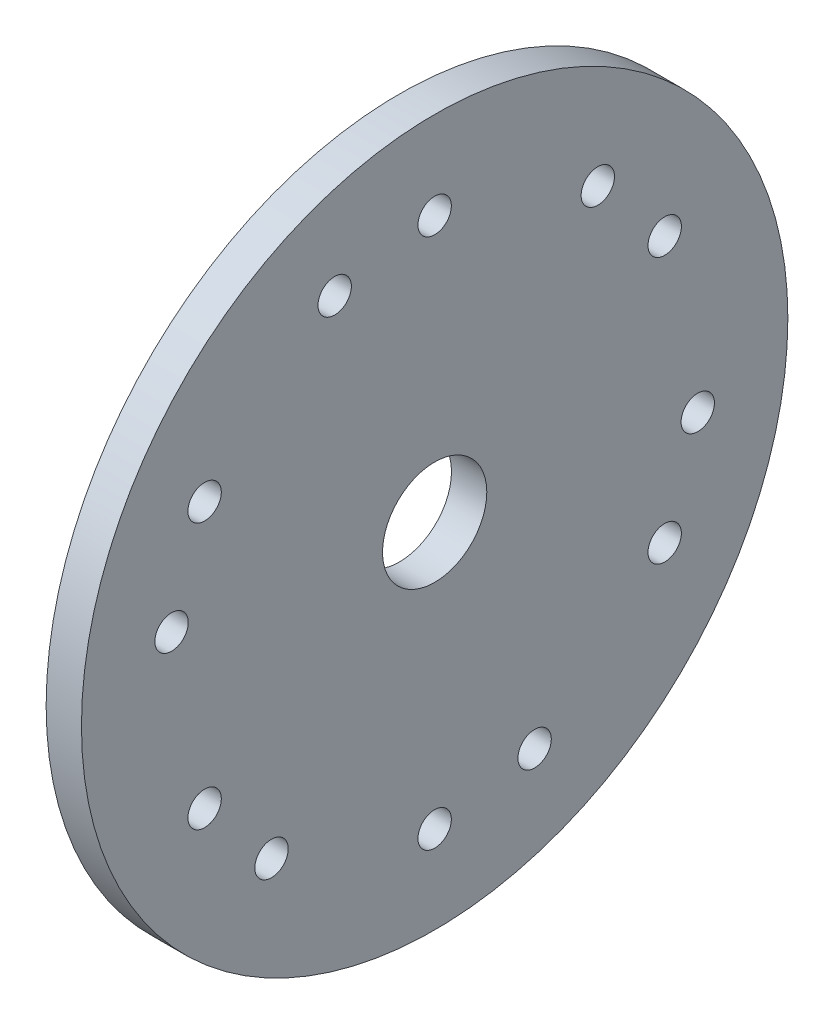
from build123d import *

# Parameters (mm, degrees)
SKETCH2_R           = 127
SKETCH2_R_2         = 6
SKETCH2_R_3         = 31.75
BOSS_EXTRUDE1_DEPTH = 6.35
SCALE1_SCALE        = 0.714781685
SCALE2_SCALE        = 0.5
BOSS_EXTRUDE2_START = -4.538863701
SKETCH3_R           = 11.347159253
SKETCH3_R_2         = 10.05
BOSS_EXTRUDE2_DEPTH = 4.538863701
SCALE3_SCALE        = 1.5
BOSS_EXTRUDE3_START = -6.808295552
SKETCH4_R           = 15.075
SKETCH4_R_2         = 10.05
BOSS_EXTRUDE3_DEPTH = 6.808295552


with BuildPart() as part:
    # Sketch2 → Boss-Extrude1 (new, symmetric)
    with BuildSketch(Plane(origin=(0, 0, 0), x_dir=(0, 0, -1), z_dir=(1, 0, 0))):
        Circle(SKETCH2_R)
        with Locations((-82.709756188, 47.7525)):
            Circle(SKETCH2_R_2, mode=Mode.SUBTRACT)
        with Locations((-35.943005468, 88.483362181)):
            Circle(SKETCH2_R_2, mode=Mode.SUBTRACT)
        with Locations((-82.709756188, -47.7525)):
            Circle(SKETCH2_R_2, mode=Mode.SUBTRACT)
        with Locations((-94.600342195, 13.114125267)):
            Circle(SKETCH2_R_2, mode=Mode.SUBTRACT)
        with Locations((0, -95.505)):
            Circle(SKETCH2_R_2, mode=Mode.SUBTRACT)
        with Locations((-58.657336727, -75.369236914)):
            Circle(SKETCH2_R_2, mode=Mode.SUBTRACT)
        with Locations((82.709756188, -47.7525)):
            Circle(SKETCH2_R_2, mode=Mode.SUBTRACT)
        with Locations((35.943005468, -88.483362181)):
            Circle(SKETCH2_R_2, mode=Mode.SUBTRACT)
        with Locations((82.709756188, 47.7525)):
            Circle(SKETCH2_R_2, mode=Mode.SUBTRACT)
        with Locations((94.600342195, -13.114125267)):
            Circle(SKETCH2_R_2, mode=Mode.SUBTRACT)
        with Locations((58.657336727, 75.369236914)):
            Circle(SKETCH2_R_2, mode=Mode.SUBTRACT)
        with Locations((0, 95.505)):
            Circle(SKETCH2_R_2, mode=Mode.SUBTRACT)
        Circle(SKETCH2_R_3, mode=Mode.SUBTRACT)
    extrude(amount=BOSS_EXTRUDE1_DEPTH, both=True)


with BuildPart() as part_1:
    # Scale1: scaled about (0, 0, 0)
    add(part.part.scale(SCALE1_SCALE))


with BuildPart() as part_2:
    # Scale2: scaled about (0, 0, 0)
    add(part_1.part.scale(SCALE2_SCALE))

    # Sketch3 → Boss-Extrude2 (add)
    with BuildSketch(Plane(origin=(2.269431851, 0, 0), x_dir=(0, 0, -1), z_dir=(1, 0, 0)).offset(BOSS_EXTRUDE2_START)):
        Circle(SKETCH3_R)
        Circle(SKETCH3_R_2, mode=Mode.SUBTRACT)
    extrude(amount=BOSS_EXTRUDE2_DEPTH)


with BuildPart() as part_3:
    # Scale3: scaled about (0, 0, 0)
    add(part_2.part.scale(SCALE3_SCALE))

    # Sketch4 → Boss-Extrude3 (add)
    with BuildSketch(Plane(origin=(3.404147776, 0, 0), x_dir=(0, 0, -1), z_dir=(1, 0, 0)).offset(BOSS_EXTRUDE3_START)):
        Circle(SKETCH4_R)
        Circle(SKETCH4_R_2, mode=Mode.SUBTRACT)
    extrude(amount=BOSS_EXTRUDE3_DEPTH)


solid = part_3.part
